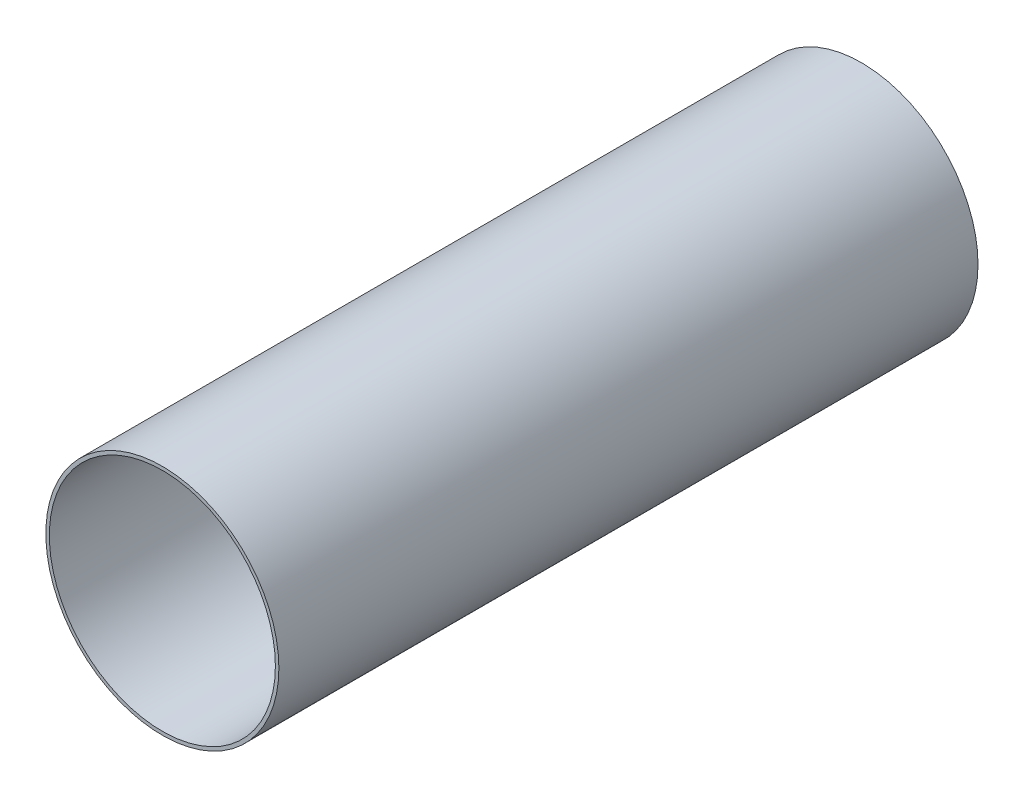
from build123d import *

# Parameters (mm, degrees)
ESBO_O1_R                = 50
RESSALTO_EXTRUS_O1_DEPTH = 300
CASCA2_T                 = -1.5


with BuildPart() as part:
    # Esboço1 → Ressalto-extrusão1 (new body)
    with BuildSketch(Plane.XY):
        Circle(ESBO_O1_R)
    extrude(amount=RESSALTO_EXTRUS_O1_DEPTH)

    # Casca2
    casca2_openings = [part.faces().sort_by_distance(p)[0] for p in [
        (0, 0, 0),
        (0, 0, 300),
    ]]
    offset(amount=CASCA2_T, openings=casca2_openings, kind=Kind.INTERSECTION)


solid = part.part
